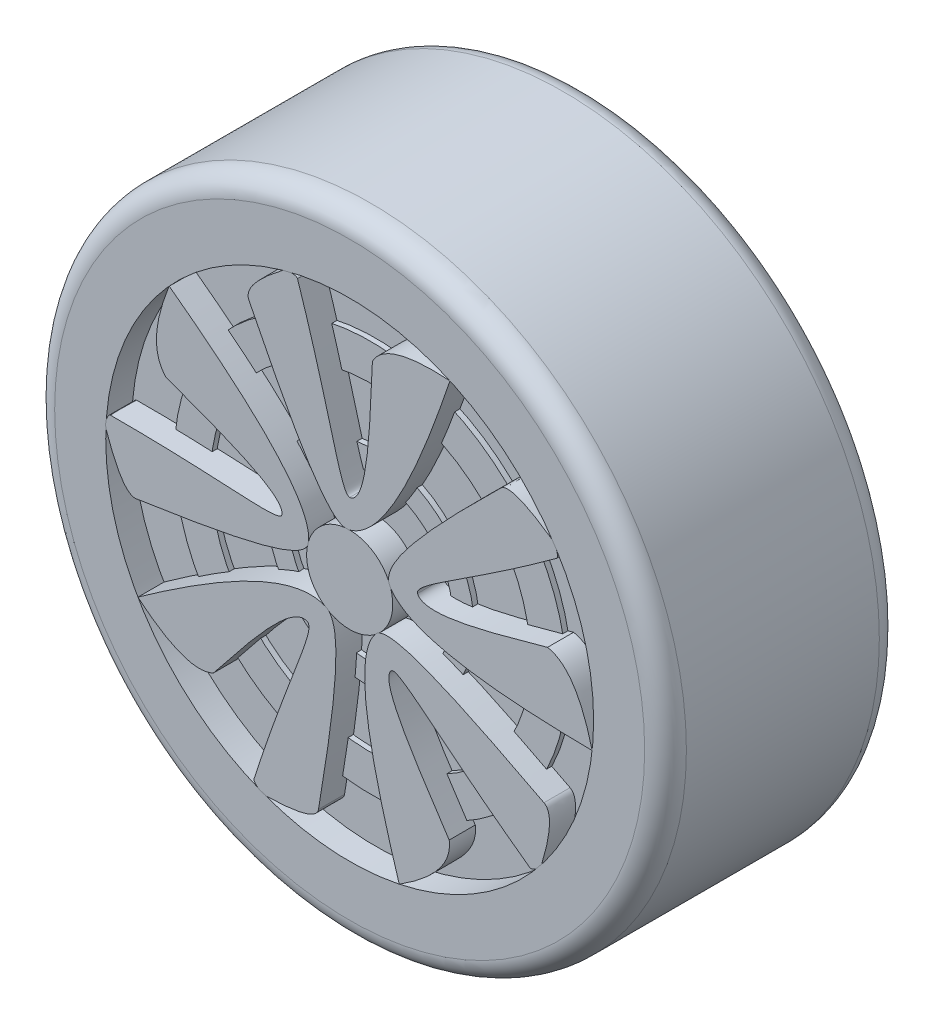
from build123d import *

# Parameters (mm, degrees)
SKETCH1_R              = 60.575003721
SKETCH1_R_2            = 46.784518766
BOSS_EXTRUDE1_DEPTH    = 45
FILLET1_R              = 4
BOSS_EXTRUDE6_DEPTH    = 5
BOSS_EXTRUDE6_2_DEPTH  = 5
BOSS_EXTRUDE6_3_DEPTH  = 5
BOSS_EXTRUDE6_4_DEPTH  = 5
BOSS_EXTRUDE6_5_DEPTH  = 5
SKETCH8_R              = 46.784518766
BOSS_EXTRUDE8_DEPTH    = 40
SKETCH9_R              = 8.26075631
BOSS_EXTRUDE10_DEPTH   = 45
SKETCH10_R             = 19.885884078
SKETCH10_R_2           = 15.713539043
BOSS_EXTRUDE12_DEPTH   = 41
SKETCH10_R_3           = 37.621422263
SKETCH10_R_4           = 30.654239113
BOSS_EXTRUDE12_2_DEPTH = 41


with BuildPart() as part:
    # Sketch1 → Boss-Extrude1 (new body)
    with BuildSketch(Plane.XY):
        with Locations(Location((136.701245964, 61.377612126, 0), (0, 0, 180))):
            Circle(SKETCH1_R)
        with Locations(Location((136.701245964, 61.377612126, 0), (0, 0, 180))):
            Circle(SKETCH1_R_2, mode=Mode.SUBTRACT)
    extrude(amount=BOSS_EXTRUDE1_DEPTH)

    # Fillet1
    fillet1_edges = [part.edges().sort_by_distance(p)[0] for p in [
        (197.276249685, 61.377612126, 0),
        (197.276249685, 61.377612126, 45),
    ]]
    fillet(fillet1_edges, radius=FILLET1_R)


with BuildPart() as body_2:
    # Sketch7 → Boss-Extrude6 (new body)
    with BuildSketch(Plane.XY.offset(45)):
        with BuildLine():
            add(Edge.make_bspline(
                [(155.93348632, 104.026318167), (151.524565265, 90.963367321), (144.325328489, 71.654033304), (136.701245964, 69.638368436)],
                knots=[0, 0, 0, 0, 1, 1, 1, 1], degree=3))
            add(Edge.make_bspline(
                [(136.701245964, 69.638368436), (133.225658151, 68.383249689), (127.35444534, 78.077385331), (117.365249602, 98.166908271)],
                knots=[0, 0, 0, 0, 1, 1, 1, 1], degree=3))
            add(Edge.make_bspline(
                [(117.365249602, 98.166908271), (116.249175053, 100.598960045), (123.908313082, 106.379079484)],
                knots=[0, 0, 0, 1, 1, 1], degree=2))
            add(Edge.make_bspline(
                [(123.908313082, 106.379079484), (125.007758265, 106.987718373), (126.527304327, 106.79258729), (126.697086347, 106.379079484)],
                knots=[0, 0, 0, 0, 1, 1, 1, 1], degree=3))
            add(Edge.make_bspline(
                [(136.701245964, 75.065982181), (134.881942078, 75.09579465), (133.213168559, 86.627125736), (126.697086347, 106.379079484)],
                knots=[0, 0, 0, 0, 1, 1, 1, 1], degree=3))
            add(Edge.make_bspline(
                [(141.062325166, 99.849272704), (140.617768037, 89.888577923), (140.277030252, 75.313973978), (136.701245964, 75.065982181)],
                knots=[0, 0, 0, 0, 1, 1, 1, 1], degree=3))
            add(Edge.make_bspline(
                [(155.93348632, 104.026318167), (143.732108684, 104.840422823), (141.062325166, 99.849272704)],
                knots=[0, 0, 0, 1, 1, 1], degree=2))
        make_face()
    extrude(amount=-BOSS_EXTRUDE6_DEPTH)


with BuildPart() as body_3:
    # Sketch7 → Boss-Extrude6 2 (new body)
    with BuildSketch(Plane.XY.offset(45)):
        with BuildLine():
            add(Edge.make_bspline(
                [(183.205664866, 56.265839567), (169.419628809, 56.422298859), (148.830674356, 57.302267545), (144.557692082, 63.930326212)],
                knots=[0, 0, 0, 0, 1, 1, 1, 1], degree=3))
            add(Edge.make_bspline(
                [(144.557692082, 63.930326212), (142.28998752, 66.847953627), (149.695353856, 75.427461489), (165.714794313, 91.135755185)],
                knots=[0, 0, 0, 0, 1, 1, 1, 1], degree=3))
            add(Edge.make_bspline(
                [(165.714794313, 91.135755185), (167.682926999, 92.948750487), (175.54695107, 87.450632491)],
                knots=[0, 0, 0, 1, 1, 1], degree=2))
            add(Edge.make_bspline(
                [(175.54695107, 87.450632491), (176.465548297, 86.593077746), (176.749533166, 85.087604741), (176.408729402, 84.798351505)],
                knots=[0, 0, 0, 0, 1, 1, 1, 1], degree=3))
            add(Edge.make_bspline(
                [(149.719659503, 65.607551098), (149.185817027, 67.347024474), (159.63708522, 72.497499676), (176.408729402, 84.798351505)],
                knots=[0, 0, 0, 0, 1, 1, 1, 1], degree=3))
            add(Edge.make_bspline(
                [(174.637617037, 69.118376254), (165.02705765, 66.463151244), (151.060491831, 62.28341183), (149.719659503, 65.607551098)],
                knots=[0, 0, 0, 0, 1, 1, 1, 1], degree=3))
            add(Edge.make_bspline(
                [(183.205664866, 56.265839567), (180.20949136, 68.12161145), (174.637617037, 69.118376254)],
                knots=[0, 0, 0, 1, 1, 1], degree=2))
        make_face()
    extrude(amount=-BOSS_EXTRUDE6_2_DEPTH)


with BuildPart() as body_4:
    # Sketch7 → Boss-Extrude6 3 (new body)
    with BuildSketch(Plane.XY.offset(45)):
        with BuildLine():
            add(Edge.make_bspline(
                [(146.210317116, 15.5696569), (142.098999318, 28.729304906), (136.57356245, 48.582489481), (141.556796696, 54.694519885)],
                knots=[0, 0, 0, 0, 1, 1, 1, 1], degree=3))
            add(Edge.make_bspline(
                [(141.556796696, 54.694519885), (143.630866013, 57.75283154), (154.078846919, 53.361123363), (173.968601341, 42.979859834)],
                knots=[0, 0, 0, 0, 1, 1, 1, 1], degree=3))
            add(Edge.make_bspline(
                [(173.968601341, 42.979859834), (176.301048783, 41.668300777), (173.502144918, 32.490157542)],
                knots=[0, 0, 0, 1, 1, 1], degree=2))
            add(Edge.make_bspline(
                [(173.502144918, 32.490157542), (172.970424044, 31.351520674), (171.626390283, 30.616218271), (171.245979954, 30.850957745)],
                knots=[0, 0, 0, 0, 1, 1, 1, 1], degree=3))
            add(Edge.make_bspline(
                [(144.747068011, 50.303488126), (146.236439102, 51.348729326), (154.36445159, 43.000566973), (171.245979954, 30.850957745)],
                knots=[0, 0, 0, 0, 1, 1, 1, 1], degree=3))
            add(Edge.make_bspline(
                [(155.786133495, 27.690006877), (150.291038272, 36.009682355), (141.999963675, 48.001065278), (144.747068011, 50.303488126)],
                knots=[0, 0, 0, 0, 1, 1, 1, 1], degree=3))
            add(Edge.make_bspline(
                [(146.210317116, 15.5696569), (156.55995769, 22.082822231), (155.786133495, 27.690006877)],
                knots=[0, 0, 0, 1, 1, 1], degree=2))
        make_face()
    extrude(amount=-BOSS_EXTRUDE6_3_DEPTH)


with BuildPart() as body_5:
    # Sketch7 → Boss-Extrude6 4 (new body)
    with BuildSketch(Plane.XY.offset(45)):
        with BuildLine():
            add(Edge.make_bspline(
                [(96.073756235, 38.1785114), (107.318858155, 46.155161856), (124.492904821, 57.545136022), (131.845695232, 54.694519885)],
                knots=[0, 0, 0, 0, 1, 1, 1, 1], degree=3))
            add(Edge.make_bspline(
                [(131.845695232, 54.694519885), (135.395245128, 53.667033021), (134.447086105, 42.373300237), (130.720189908, 20.249032833)],
                knots=[0, 0, 0, 0, 1, 1, 1, 1], degree=3))
            add(Edge.make_bspline(
                [(130.720189908, 20.249032833), (130.193589019, 17.625449457), (120.599747228, 17.45116298)],
                knots=[0, 0, 0, 1, 1, 1], degree=2))
            add(Edge.make_bspline(
                [(120.599747228, 17.45116298), (119.352528428, 17.605001439), (118.237885013, 18.656032567), (118.343582264, 19.090362776)],
                knots=[0, 0, 0, 0, 1, 1, 1, 1], degree=3))
            add(Edge.make_bspline(
                [(128.655423918, 50.303488126), (130.10974835, 49.210009338), (124.681868135, 38.900086058), (118.343582264, 19.090362776)],
                knots=[0, 0, 0, 0, 1, 1, 1, 1], degree=3))
            add(Edge.make_bspline(
                [(110.559984057, 32.816762955), (116.774387824, 40.613830185), (125.61678774, 52.204651817), (128.655423918, 50.303488126)],
                knots=[0, 0, 0, 0, 1, 1, 1, 1], degree=3))
            add(Edge.make_bspline(
                [(96.073756235, 38.1785114), (105.466359388, 30.348097066), (110.559984057, 32.816762955)],
                knots=[0, 0, 0, 1, 1, 1], degree=2))
        make_face()
    extrude(amount=-BOSS_EXTRUDE6_4_DEPTH)


with BuildPart() as body_6:
    # Sketch7 → Boss-Extrude6 5 (new body)
    with BuildSketch(Plane.XY.offset(45)):
        with BuildLine():
            add(Edge.make_bspline(
                [(102.083005282, 92.847734595), (113.144178273, 84.617927687), (129.283759705, 71.804134277), (128.844799846, 63.930326212)],
                knots=[0, 0, 0, 0, 1, 1, 1, 1], degree=3))
            add(Edge.make_bspline(
                [(128.844799846, 63.930326212), (128.964473009, 60.236992752), (117.9304976, 57.648790208), (95.737394656, 54.356504506)],
                knots=[0, 0, 0, 0, 1, 1, 1, 1], degree=3))
            add(Edge.make_bspline(
                [(95.737394656, 54.356504506), (93.079489966, 54.046599863), (89.949073522, 63.117028132)],
                knots=[0, 0, 0, 1, 1, 1], degree=2))
            add(Edge.make_bspline(
                [(89.949073522, 63.117028132), (89.709970786, 64.350742397), (90.365117031, 65.735617761), (90.810851854, 65.769309118)],
                knots=[0, 0, 0, 0, 1, 1, 1, 1], degree=3))
            add(Edge.make_bspline(
                [(123.682832425, 65.607551098), (123.092283264, 63.886502842), (111.609656316, 65.862782186), (90.810851854, 65.769309118)],
                knots=[0, 0, 0, 0, 1, 1, 1, 1], degree=3))
            add(Edge.make_bspline(
                [(101.460170066, 77.413641839), (110.795978037, 73.912818922), (124.551956324, 69.084957726), (123.682832425, 65.607551098)],
                knots=[0, 0, 0, 0, 1, 1, 1, 1], degree=3))
            add(Edge.make_bspline(
                [(102.083005282, 92.847734595), (97.5383127, 81.495107059), (101.460170066, 77.413641839)],
                knots=[0, 0, 0, 1, 1, 1], degree=2))
        make_face()
    extrude(amount=-BOSS_EXTRUDE6_5_DEPTH)


with BuildPart() as body_7:
    # Sketch8 → Boss-Extrude8 (new body)
    with BuildSketch(Plane.XY):
        with Locations(Location((136.701245964, 61.377612126, 0), (0, 0, 180))):
            Circle(SKETCH8_R)
    extrude(amount=BOSS_EXTRUDE8_DEPTH)


with BuildPart() as body_8:
    # Sketch9 → Boss-Extrude10 (new body)
    with BuildSketch(Plane.XY):
        with Locations(Location((136.701245964, 61.377612126, 0), (0, 0, 180))):
            Circle(SKETCH9_R)
    extrude(amount=BOSS_EXTRUDE10_DEPTH)


with BuildPart() as body_9:
    # Sketch10 → Boss-Extrude12 (new body)
    with BuildSketch(Plane.XY):
        with Locations((136.701245964, 61.377612126)):
            Circle(SKETCH10_R)
        with Locations((136.701245964, 61.377612126)):
            Circle(SKETCH10_R_2, mode=Mode.SUBTRACT)
    extrude(amount=BOSS_EXTRUDE12_DEPTH)


with BuildPart() as body_10:
    # Sketch10 → Boss-Extrude12 2 (new body)
    with BuildSketch(Plane.XY):
        with Locations((136.701245964, 61.377612126)):
            Circle(SKETCH10_R_3)
        with Locations((136.701245964, 61.377612126)):
            Circle(SKETCH10_R_4, mode=Mode.SUBTRACT)
    extrude(amount=BOSS_EXTRUDE12_2_DEPTH)


solid = Compound([part.part, body_2.part, body_3.part, body_4.part, body_5.part, body_6.part, body_7.part, body_8.part, body_9.part, body_10.part])
